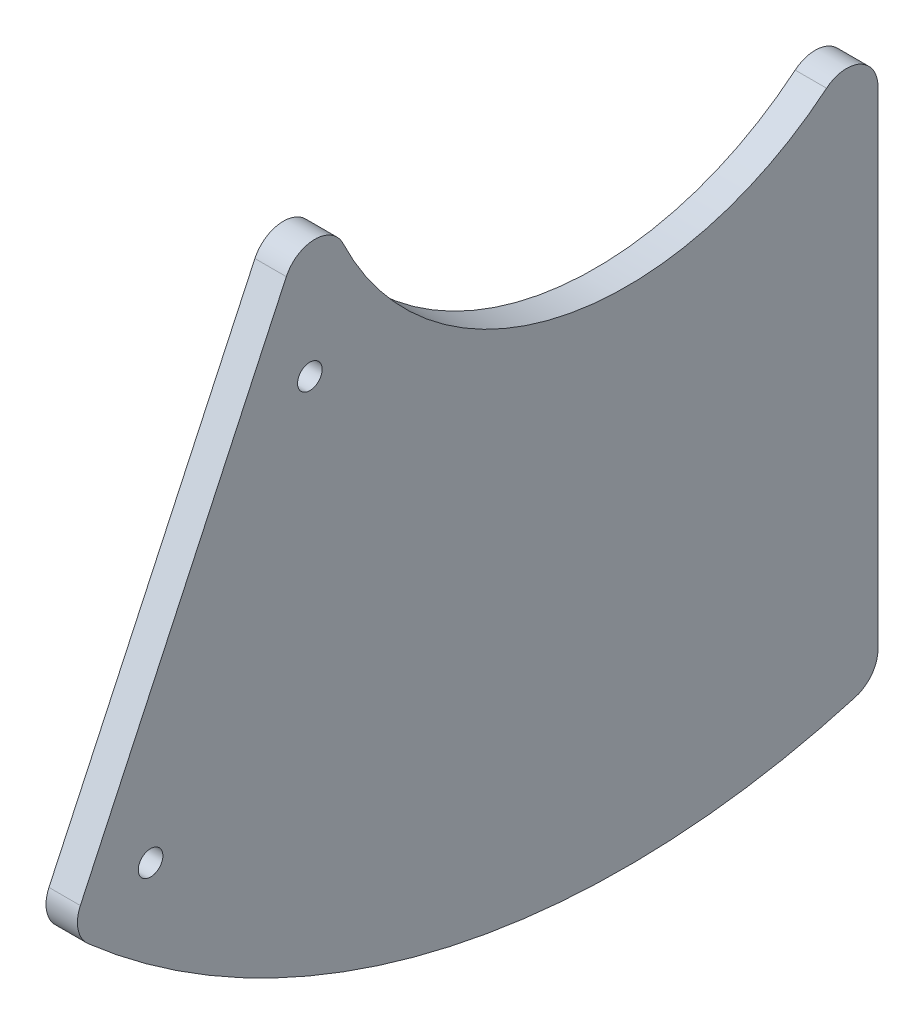
from build123d import *

# Parameters (mm, degrees)
BOSS_EXTRUDE1_DEPTH        = 6.35
F_9_0_196_DIAMETER_HOLE1_D = 4.9784
FILLET1_R                  = 6.35


with BuildPart() as part:
    # Sketch1 → Boss-Extrude1 (new body)
    with BuildSketch(Plane.YZ):
        with BuildLine():
            Line((-13.06131899, 62.142191354), (-120.903176517, 112.429675389))
            ThreePointArc((-120.903176517, 112.429675389), (-161.186470776, 35.734180261), (-157.090324336, -50.8))
            Line((-157.090324336, -50.8), (-38.1, -50.8))
            ThreePointArc((-38.1, -50.8), (-61.994796452, 13.743915485), (-13.06131899, 62.142191354))
        make_face()
    extrude(amount=BOSS_EXTRUDE1_DEPTH)

    # #9 (0.196) Diameter Hole1 (through all)
    with Locations(Plane.YZ.offset(6.35)):
        with Locations((-116.264496524, 96.253723813), (-47.203843152, 64.050212269)):
            Hole(F_9_0_196_DIAMETER_HOLE1_D / 2)

    # Fillet1
    fillet1_edges = [part.edges().sort_by_distance(p)[0] for p in [
        (3.175, -120.903176517, 112.429675389),
        (3.175, -13.06131899, 62.142191354),
        (3.175, -38.1, -50.8),
        (3.175, -157.090324336, -50.8),
    ]]
    fillet(fillet1_edges, radius=FILLET1_R)


solid = part.part
